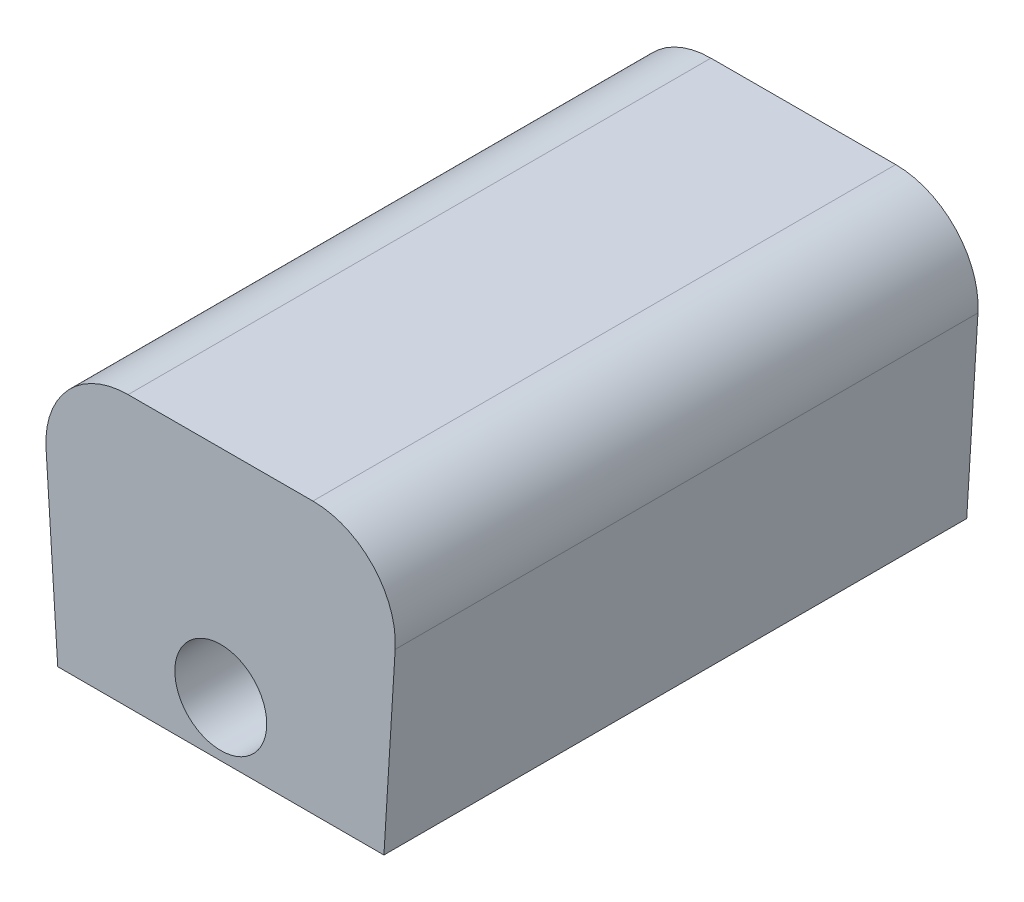
from build123d import *

# Parameters (mm, degrees)
SKETCH1_R           = 2.127
BOSS_EXTRUDE1_DEPTH = 26.9748
SKETCH2_W           = 26.435794454
SKETCH2_H           = 30.822496662
CUT_EXTRUDE1_DEPTH  = 26.9748


with BuildPart() as part:
    # Sketch1 → Boss-Extrude1 (new body)
    with BuildSketch(Plane.XY):
        with BuildLine():
            Line((-14.243742807, 12.883798414), (-12.548531911, 40.559464476))
            ThreePointArc((-12.548531911, 40.559464476), (-13.577816221, 43.404547078), (-16.356138454, 44.602397978))
            Line((-16.356138454, 44.602397978), (-24.910163506, 44.591769732))
            ThreePointArc((-24.910163506, 44.591769732), (-27.685500542, 43.387018496), (-28.707711742, 40.539386942))
            Line((-28.707711742, 40.539386942), (-26.943733004, 12.86801887))
            ThreePointArc((-26.943733004, 12.86801887), (-20.586009882, 6.656095002), (-14.243742807, 12.883798414))
        make_face()
        with Locations((-20.620724878, 34.596073435)):
            Circle(SKETCH1_R, mode=Mode.SUBTRACT)
        with Locations((-20.592321699, 11.736091081)):
            Circle(SKETCH1_R, mode=Mode.SUBTRACT)
    extrude(amount=BOSS_EXTRUDE1_DEPTH)

    # Sketch2 → Cut-Extrude1 (cut)
    with BuildSketch(Plane.XY.offset(26.9748)):
        with Locations((-21.417297129, 16.644825104)):
            Rectangle(SKETCH2_W, SKETCH2_H)
    extrude(amount=-CUT_EXTRUDE1_DEPTH, mode=Mode.SUBTRACT)


solid = part.part
